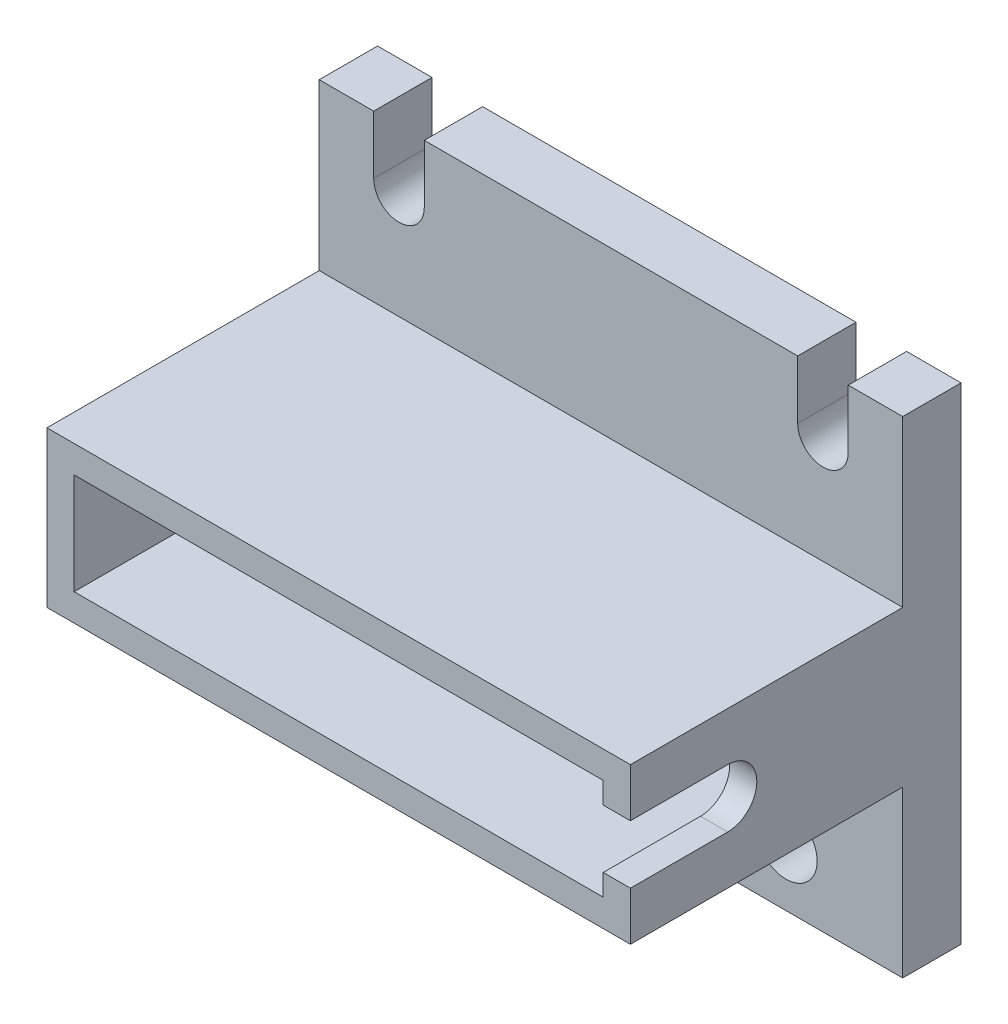
from build123d import *

# Parameters (mm, degrees)
SKETCH_1_W          = 150
SKETCH_1_H          = 125
EXTRUDE_1_DEPTH     = 15
SKETCH_2_W          = 150
SKETCH_2_H          = 40
EXTRUDE_2_DEPTH     = 70
SKETCH_3_W          = 136
SKETCH_3_H          = 26
CUT_EXTRUDE_1_DEPTH = 130.44593466
SKETCH_4_R          = 8
CUT_EXTRUDE_2_DEPTH = 121.130137767
RIB_1_REACH         = 131.446
SKETCH_5_WALL_W     = 342.78356609
SKETCH_5_WALL_H     = 20
CUT_EXTRUDE1_REACH  = 185.388


with BuildPart() as part:
    # Эскиз1 → Бобышка-Вытянуть1 (new body)
    with BuildSketch(Plane.XY):
        Rectangle(SKETCH_1_W, SKETCH_1_H)
    extrude(amount=EXTRUDE_1_DEPTH)

    # Эскиз2 → Бобышка-Вытянуть2 (add)
    with BuildSketch(Plane.XY.offset(15)):
        Rectangle(SKETCH_2_W, SKETCH_2_H)
    extrude(amount=EXTRUDE_2_DEPTH)

    # Эскиз3 → Вырез-Вытянуть1 (cut, through all)
    with BuildSketch(Plane.XY.offset(85)):
        Rectangle(SKETCH_3_W, SKETCH_3_H)
    extrude(amount=-CUT_EXTRUDE_1_DEPTH, mode=Mode.SUBTRACT)

    # Эскиз4 → Вырез-Вытянуть2 (cut, through all)
    with BuildSketch(Plane.XY.offset(15)):
        with BuildLine():
            Line((48, 62.5), (48, 47.5))
            ThreePointArc((48, 47.5), (54.5, 41), (61, 47.5))
            Line((61, 47.5), (61, 62.5))
            Line((61, 62.5), (48, 62.5))
        make_face()
        with Locations((45, -47.5)):
            Circle(SKETCH_4_R)
    cut_extrude_2 = extrude(amount=-CUT_EXTRUDE_2_DEPTH, mode=Mode.SUBTRACT)

    # Эскиз5 wall → Ребро1 (add, up to next)
    with BuildSketch(Plane(origin=(0, -41.25, 50), x_dir=(0, -0.518978134242, -0.854787515222), z_dir=(0, 0.854787515222, -0.518978134242)), mode=Mode.PRIVATE) as rib_1_sk1:
        Rectangle(SKETCH_5_WALL_W, SKETCH_5_WALL_H)
    rib_1_tool1 = extrude(rib_1_sk1.sketch, amount=RIB_1_REACH, mode=Mode.PRIVATE) - part.part
    add(rib_1_tool1.solids().sort_by_distance((0, -41.25, 50))[0])

    # Зеркальное отражение1: Вырез-Вытянуть2 across plane
    add(cut_extrude_2.mirror(Plane(origin=(0, 0, 0), x_dir=(0, 0, 1), z_dir=(1, 0, 0))), mode=Mode.SUBTRACT)

    # Sketch1 → Cut-Extrude1 (cut, up to next)
    with BuildSketch(Plane(origin=(75, 0, 0), x_dir=(0, 0, -1), z_dir=(1, 0, 0)), mode=Mode.PRIVATE) as cut_extrude1_sk1:
        with BuildLine():
            Line((-85, 7.5), (-60, 7.5))
            ThreePointArc((-60, 7.5), (-52.5, 0), (-60, -7.5))
            Line((-60, -7.5), (-85, -7.5))
            ThreePointArc((-85, -7.5), (-92.5, 0), (-85, 7.5))
        make_face()
    cut_extrude1_tool1 = extrude(cut_extrude1_sk1.sketch, amount=-CUT_EXTRUDE1_REACH, mode=Mode.PRIVATE) & part.part
    add(cut_extrude1_tool1.solids().sort_by_distance((75, 0, 72.5))[0], mode=Mode.SUBTRACT)


solid = part.part
